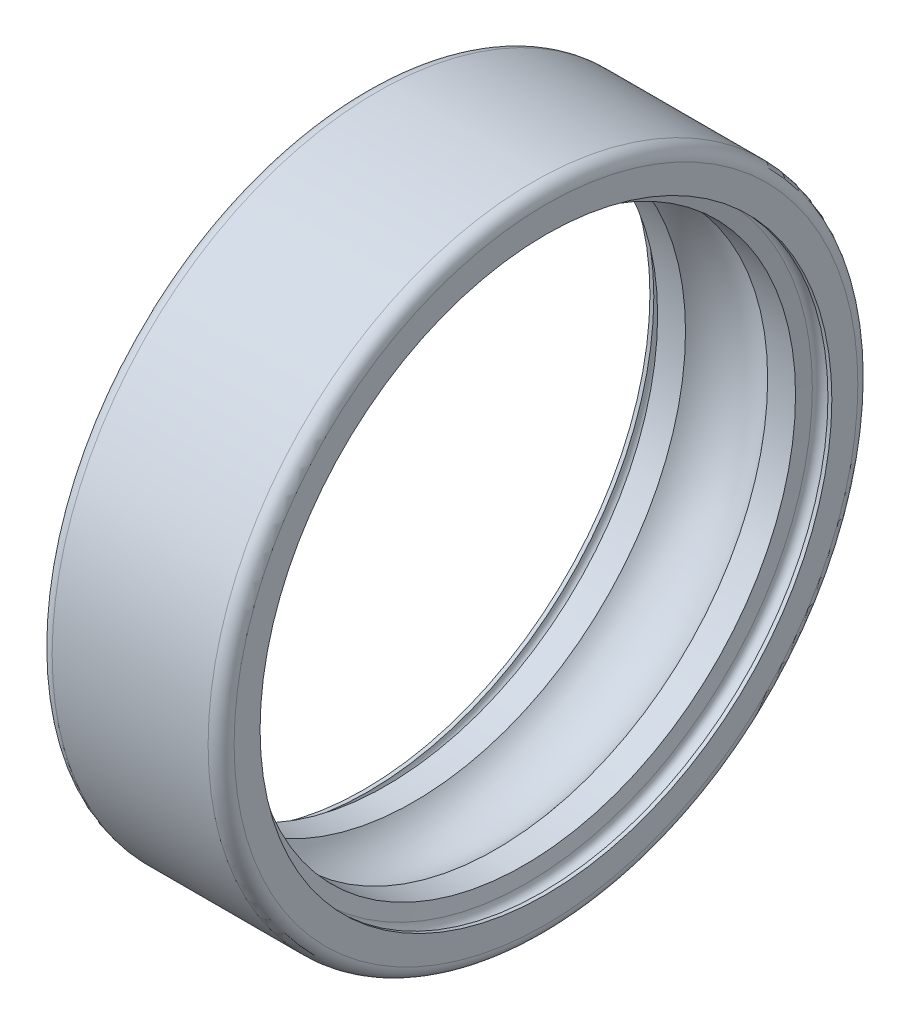
from build123d import *


with BuildPart() as part:
    # Sketch1 → Revolução1 (revolve)
    with BuildSketch(Plane.XY, mode=Mode.PRIVATE) as revolu_o1_sk:
        with BuildLine():
            Line((0, 22), (0.3, 22))
            ThreePointArc((0.3, 22), (0.9, 22.6), (1.5, 22))
            Line((1.5, 22), (1.693959679, 20.9))
            Line((1.693959679, 20.9), (3.838835499, 20.9))
            ThreePointArc((3.838835499, 20.9), (7, 22.469), (10.161164501, 20.9))
            Line((10.161164501, 20.9), (12.306040321, 20.9))
            Line((12.306040321, 20.9), (12.5, 22))
            ThreePointArc((12.5, 22), (13.1, 22.6), (13.7, 22))
            Line((13.7, 22), (14, 22))
            Line((14, 22), (14, 24))
            ThreePointArc((14, 24), (13.707106781, 24.707106781), (13, 25))
            Line((13, 25), (1, 25))
            ThreePointArc((1, 25), (0.292893219, 24.707106781), (0, 24))
            Line((0, 24), (0, 22))
        make_face()
    revolve(revolu_o1_sk.sketch.rotate(Axis((50, 0, 0), (-1, 0, 0)), 270), axis=Axis((50, 0, 0), (-1, 0, 0)))


solid = part.part
